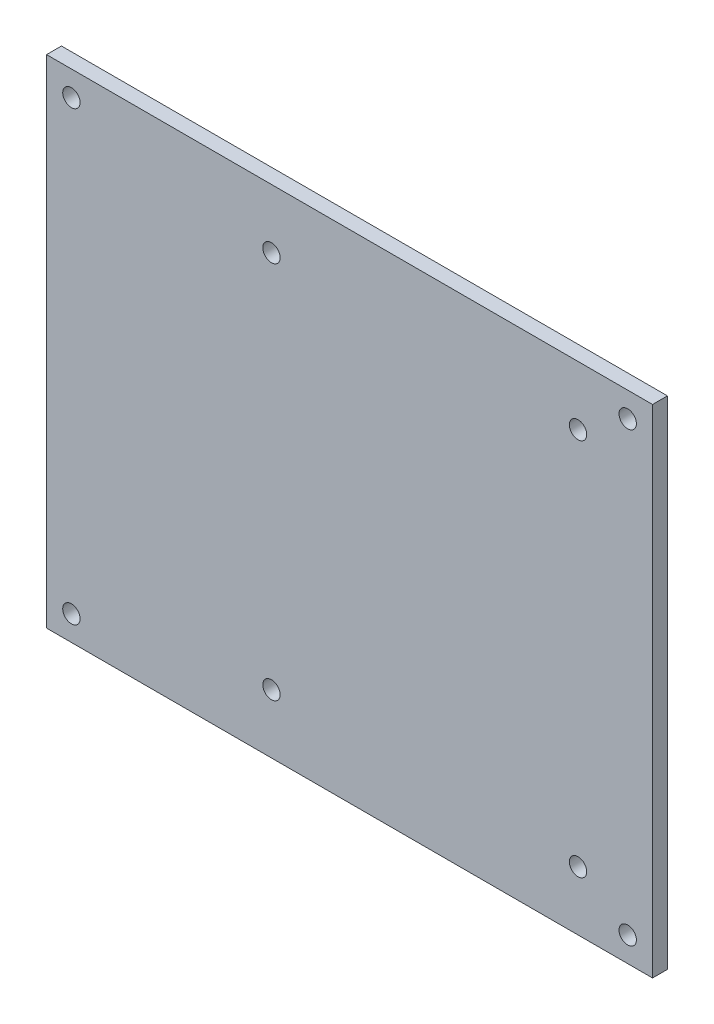
from build123d import *

# Parameters (mm, degrees)
SKETCH1_W           = 100
SKETCH1_H           = 122
SKETCH1_R           = 1.75
BOSS_EXTRUDE1_DEPTH = 3


with BuildPart() as part:
    # Sketch1 → Boss-Extrude1 (new body)
    with BuildSketch(Plane(origin=(0, 0, 0), x_dir=(0, 1, 0), z_dir=(0, 0, 1))):
        Rectangle(SKETCH1_W, SKETCH1_H)
        with Locations(Location((-45, 56, 0), (0, 0, 270))):
            Circle(SKETCH1_R, mode=Mode.SUBTRACT)
        with Locations(Location((45, 56, 0), (0, 0, 270))):
            Circle(SKETCH1_R, mode=Mode.SUBTRACT)
        with Locations(Location((-45, -56, 0), (0, 0, 270))):
            Circle(SKETCH1_R, mode=Mode.SUBTRACT)
        with Locations(Location((45, -56, 0), (0, 0, 270))):
            Circle(SKETCH1_R, mode=Mode.SUBTRACT)
        with Locations(Location((-38.1, -46, 0), (0, 0, 270))):
            Circle(SKETCH1_R, mode=Mode.SUBTRACT)
        with Locations(Location((38.1, -46, 0), (0, 0, 270))):
            Circle(SKETCH1_R, mode=Mode.SUBTRACT)
        with Locations(Location((-38.1, 15.72, 0), (0, 0, 270))):
            Circle(SKETCH1_R, mode=Mode.SUBTRACT)
        with Locations(Location((38.1, 15.72, 0), (0, 0, 270))):
            Circle(SKETCH1_R, mode=Mode.SUBTRACT)
    extrude(amount=BOSS_EXTRUDE1_DEPTH)


solid = part.part
